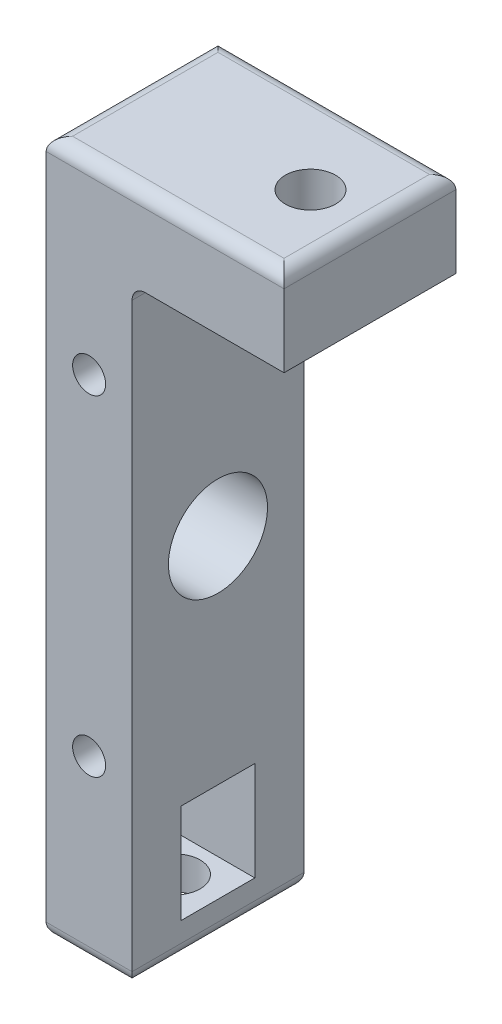
from build123d import *

# Parameters (mm, degrees)
BOSS_EXTRUDE1_DEPTH = 33.02
FILLET1_R           = 2.54
SKETCH4_R           = 9.525
CUT_EXTRUDE1_DEPTH  = 141.448449618
SKETCH5_R           = 3.175
CUT_EXTRUDE2_DEPTH  = 145.785570068
SKETCH6_W           = 14.1732
SKETCH6_H           = 19.05
CUT_EXTRUDE3_DEPTH  = 141.448449618
SKETCH7_R           = 4.826
CUT_EXTRUDE4_DEPTH  = 6.35
SKETCH8_R           = 4.826
CUT_EXTRUDE5_DEPTH  = 145.785570068
FILLET2_R           = 2.54
FILLET3_R           = 2.54


with BuildPart() as part:
    # Sketch1 → Boss-Extrude1 (new body)
    with BuildSketch(Plane.XY):
        Polygon((0, 0), (-45.72, 0), (-45.72, -133.35), (-29.21, -133.35), (-29.21, -16.51), (0, -16.51), align=None)
    extrude(amount=BOSS_EXTRUDE1_DEPTH)

    # Fillet1
    fillet1_edges = [part.edges().sort_by_distance(p)[0] for p in [
        (-45.72, 0, 16.51),
        (0, 0, 16.51),
        (-22.86, 0, 33.02),
        (-22.86, 0, 0),
    ]]
    fillet(fillet1_edges, radius=FILLET1_R)

    # Sketch4 → Cut-Extrude1 (cut, through all)
    with BuildSketch(Plane(origin=(-29.21, 0, 0), x_dir=(0, 0, -1), z_dir=(1, 0, 0))):
        with Locations(Location((-16.51, -66.548, 0), (0, 0, 90))):
            Circle(SKETCH4_R)
    extrude(amount=-CUT_EXTRUDE1_DEPTH, mode=Mode.SUBTRACT)

    # Sketch5 → Cut-Extrude2 (cut, through all)
    with BuildSketch(Plane.XY.offset(33.02)):
        with Locations((-37.465, -35.56)):
            Circle(SKETCH5_R)
        with Locations((-37.465, -99.06)):
            Circle(SKETCH5_R)
    extrude(amount=-CUT_EXTRUDE2_DEPTH, mode=Mode.SUBTRACT)

    # Sketch6 → Cut-Extrude3 (cut, through all)
    with BuildSketch(Plane(origin=(-29.21, 0, 0), x_dir=(0, 0, -1), z_dir=(1, 0, 0))):
        with Locations((-16.51, -117.475)):
            Rectangle(SKETCH6_W, SKETCH6_H)
    extrude(amount=-CUT_EXTRUDE3_DEPTH, mode=Mode.SUBTRACT)

    # Sketch7 → Cut-Extrude4 (cut)
    with BuildSketch(Plane.XZ.offset(133.35)):
        with Locations(Location((-37.465, 16.51, 0), (0, 0, 270))):
            Circle(SKETCH7_R)
    extrude(amount=-CUT_EXTRUDE4_DEPTH, mode=Mode.SUBTRACT)

    # Sketch8 → Cut-Extrude5 (cut, through all)
    with BuildSketch(Plane(origin=(0, 0, 0), x_dir=(1, 0, 0), z_dir=(0, 1, 0))):
        with Locations(Location((-11.43, -16.51, 0), (0, 0, 180))):
            Circle(SKETCH8_R)
    extrude(amount=-CUT_EXTRUDE5_DEPTH, mode=Mode.SUBTRACT)

    # Fillet2
    fillet2_edges = [part.edges().sort_by_distance(p)[0] for p in [
        (-29.21, -133.35, 16.51),
        (-45.72, -133.35, 16.51),
        (-37.465, -133.35, 33.02),
        (-37.465, -133.35, 0),
    ]]
    fillet(fillet2_edges, radius=FILLET2_R)

    # Fillet3
    fillet3_edges = [part.edges().sort_by_distance(p)[0] for p in [
        (-29.21, -16.51, 16.51),
    ]]
    fillet(fillet3_edges, radius=FILLET3_R)


solid = part.part
